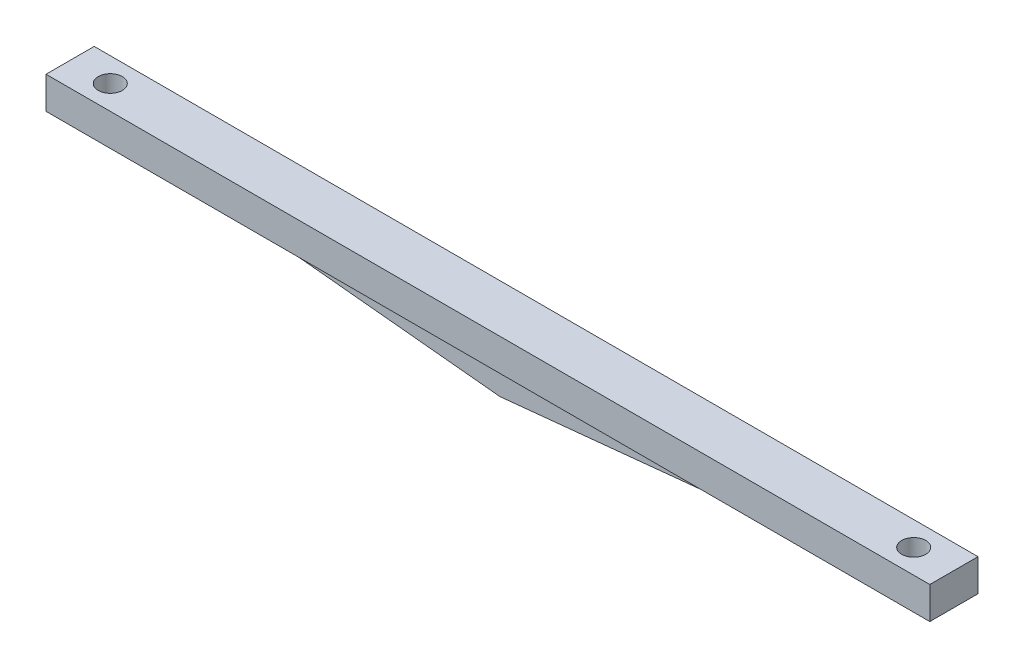
from build123d import *

# Parameters (mm, degrees)
SKETCH1_W                = 110
SKETCH1_H                = 4
BOSS_EXTRUDE1_DEPTH      = 3
BOSS_EXTRUDE2_DEPTH      = 1.5
F_3_0_3_DIAMETER_HOLE1_D = 3


with BuildPart() as part:
    # Sketch1 → Boss-Extrude1 (new, symmetric)
    with BuildSketch(Plane.XY):
        Rectangle(SKETCH1_W, SKETCH1_H)
    extrude(amount=BOSS_EXTRUDE1_DEPTH, both=True)

    # Sketch2 → Boss-Extrude2 (add, symmetric)
    with BuildSketch(Plane.XY):
        Polygon((-40, -2), (0, -6), (40, -2), align=None)
    extrude(amount=BOSS_EXTRUDE2_DEPTH, both=True)

    # Ø3.0 (3) Diameter Hole1 (through all)
    with Locations(Plane(origin=(0, 2, 0), x_dir=(1, 0, 0), z_dir=(0, 1, 0))):
        with Locations((-50, 0), (50, 0)):
            Hole(F_3_0_3_DIAMETER_HOLE1_D / 2)


solid = part.part
